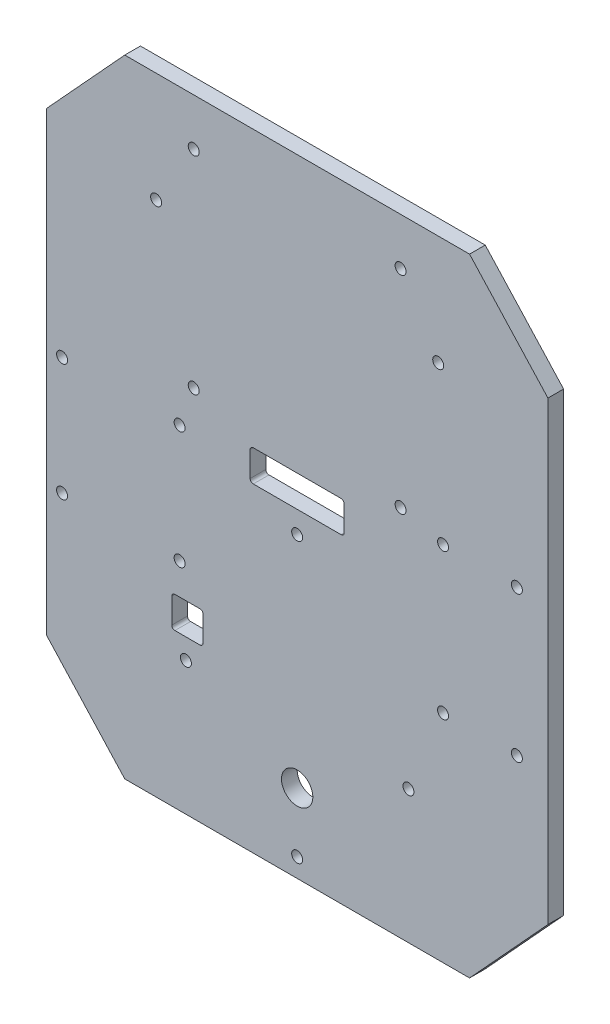
from build123d import *

# Parameters (mm, degrees)
ESQUISSE1_W               = 200
ESQUISSE1_H               = 160
ESQUISSE1_R               = 5
ESQUISSE1_R_2             = 1.75
ESQUISSE1_W_2             = 10
ESQUISSE1_H_2             = 10
ESQUISSE1_H_3             = 30
BOSS_EXTRU_1_DEPTH        = 5
CONG_2_R                  = 1
ENL_V_MAT_EXTRU_1_DEPTH   = 129.16005618
ESQUISSE3_R               = 1.75
TROU_CUVE_DIRECTION_DEPTH = 129.16005618


with BuildPart() as part:
    # Esquisse1 → Boss.-Extru.1 (new body)
    with BuildSketch(Plane(origin=(0, 0, 0), x_dir=(0, 1, 0), z_dir=(0, 0, 1))):
        Rectangle(ESQUISSE1_W, ESQUISSE1_H)
        with Locations(Location((-75, 0, 0), (0, 0, 270))):
            Circle(ESQUISSE1_R, mode=Mode.SUBTRACT)
        with Locations(Location((-57.5, 35.5, 0), (0, 0, 270))):
            Circle(ESQUISSE1_R_2, mode=Mode.SUBTRACT)
        with Locations(Location((-57.5, -35.5, 0), (0, 0, 90))):
            Circle(ESQUISSE1_R_2, mode=Mode.SUBTRACT)
        with Locations(Location((65, 45, 0), (0, 0, 270))):
            Circle(ESQUISSE1_R_2, mode=Mode.SUBTRACT)
        with Locations(Location((65, -45, 0), (0, 0, 90))):
            Circle(ESQUISSE1_R_2, mode=Mode.SUBTRACT)
        with Locations(Location((-31, 37.5, 0), (0, 0, 270))):
            Circle(ESQUISSE1_R_2, mode=Mode.SUBTRACT)
        with Locations(Location((-31, 75, 0), (0, 0, 270))):
            Circle(ESQUISSE1_R_2, mode=Mode.SUBTRACT)
        with Locations(Location((6.5, 75, 0), (0, 0, 270))):
            Circle(ESQUISSE1_R_2, mode=Mode.SUBTRACT)
        with Locations(Location((6.5, 37.5, 0), (0, 0, 270))):
            Circle(ESQUISSE1_R_2, mode=Mode.SUBTRACT)
        with Locations(Location((-31, -46.541307377, 0), (0, 0, 270))):
            Circle(ESQUISSE1_R_2, mode=Mode.SUBTRACT)
        with Locations(Location((-31, -70.091307377, 0), (0, 0, 270))):
            Circle(ESQUISSE1_R_2, mode=Mode.SUBTRACT)
        with Locations(Location((15.5, -46.541307377, 0), (0, 0, 270))):
            Circle(ESQUISSE1_R_2, mode=Mode.SUBTRACT)
        with Locations(Location((15.5, -70.091307377, 0), (0, 0, 270))):
            Circle(ESQUISSE1_R_2, mode=Mode.SUBTRACT)
        with Locations(Location((-4.999283545, 0, 0), (0, 0, 270))):
            Circle(ESQUISSE1_R_2, mode=Mode.SUBTRACT)
        with Locations(Location((85, 33, 0), (0, 0, 270))):
            Circle(ESQUISSE1_R_2, mode=Mode.SUBTRACT)
        with Locations(Location((85.001189598, -32.999999989, 0), (0, 0, 270))):
            Circle(ESQUISSE1_R_2, mode=Mode.SUBTRACT)
        with Locations(Location((19, 33, 0), (0, 0, 270))):
            Circle(ESQUISSE1_R_2, mode=Mode.SUBTRACT)
        with Locations(Location((19.001189598, -32.999999989, 0), (0, 0, 270))):
            Circle(ESQUISSE1_R_2, mode=Mode.SUBTRACT)
        with Locations((-46, 35)):
            Rectangle(ESQUISSE1_W_2, ESQUISSE1_H_2, mode=Mode.SUBTRACT)
        with Locations((7, 0)):
            Rectangle(ESQUISSE1_W_2, ESQUISSE1_H_3, mode=Mode.SUBTRACT)
    extrude(amount=BOSS_EXTRU_1_DEPTH)

    # Congé2
    cong_2_edges = [part.edges().sort_by_distance(p)[0] for p in [
        (-40, -51, 2.5),
        (-30, -51, 2.5),
        (-30, -41, 2.5),
        (-40, -41, 2.5),
        (-15, 2, 2.5),
        (15, 2, 2.5),
        (15, 12, 2.5),
        (-15, 12, 2.5),
    ]]
    fillet(cong_2_edges, radius=CONG_2_R)

    # Esquisse2 → Enlèv. mat.-Extru.1 (cut, through all)
    with BuildSketch(Plane.XY.offset(5)):
        Polygon((-573.580399643, 598.167108478), (-698.698151963, -488.082468479), (684.299979338, -647.380682556), (762.904681953, 702.431902078), align=None)
        Polygon((-110, 40), (0, 160), (110, 40), (110, -40), (0, -160), (-110, -40), align=None, mode=Mode.SUBTRACT)
    extrude(amount=-ENL_V_MAT_EXTRU_1_DEPTH, mode=Mode.SUBTRACT)

    # Esquisse3 → Trou cuve direction (cut, through all)
    with BuildSketch(Plane(origin=(0, 0, 0), x_dir=(0, 1, 0), z_dir=(0, 0, 1))):
        with Locations(Location((-94.001515359, 0.004041019, 0), (0, 0, 270))):
            Circle(ESQUISSE3_R)
    extrude(amount=TROU_CUVE_DIRECTION_DEPTH, mode=Mode.SUBTRACT)


solid = part.part
